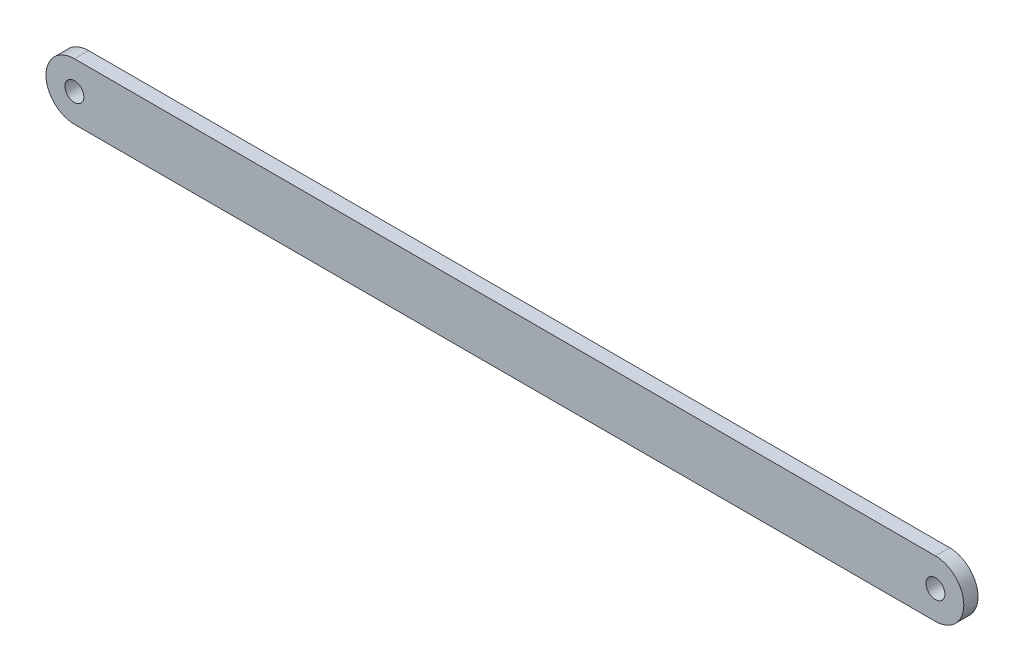
from build123d import *

# Parameters (mm, degrees)
SKETCH1_R           = 2
BOSS_EXTRUDE3_DEPTH = 3


with BuildPart() as part:
    # Sketch1 → Boss-Extrude3 (new body)
    with BuildSketch(Plane.XY):
        with BuildLine():
            Line((-35.312724167, 6), (146.687275833, 6))
            ThreePointArc((146.687275833, 6), (152.687275833, 0), (146.687275833, -6))
            Line((146.687275833, -6), (-35.312724167, -6))
            ThreePointArc((-35.312724167, -6), (-41.312724167, 0), (-35.312724167, 6))
        make_face()
        with Locations((-35.312724167, 0)):
            Circle(SKETCH1_R, mode=Mode.SUBTRACT)
        with Locations((146.687275833, 0)):
            Circle(SKETCH1_R, mode=Mode.SUBTRACT)
    extrude(amount=BOSS_EXTRUDE3_DEPTH)


solid = part.part
